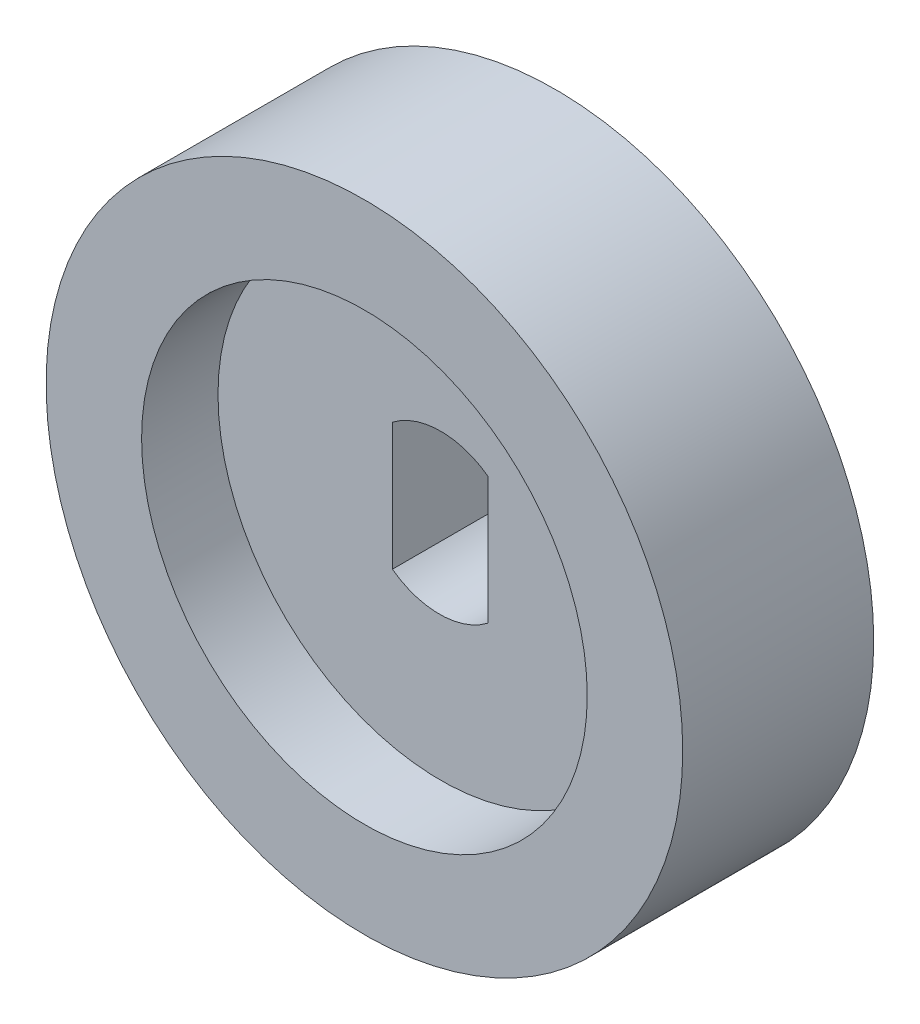
from build123d import *

# Parameters (mm, degrees)
SKETCH1_R           = 10
BOSS_EXTRUDE1_DEPTH = 3
SKETCH2_R           = 7
CUT_EXTRUDE1_DEPTH  = 2.4


with BuildPart() as part:
    # Sketch1 → Boss-Extrude1 (new, symmetric)
    with BuildSketch(Plane.XY):
        Circle(SKETCH1_R)
        with BuildLine():
            Line((-1.521572539, 1.983637318), (-1.521572539, -2.016362682))
            ThreePointArc((-1.521572539, -2.016362682), (-0.016245384, -2.500087973), (1.478251514, -1.983871914))
            Line((1.478251514, -1.983871914), (1.478251514, 2.016128086))
            ThreePointArc((1.478251514, 2.016128086), (-0.02707564, 2.499853378), (-1.521572539, 1.983637318))
        make_face(mode=Mode.SUBTRACT)
    extrude(amount=BOSS_EXTRUDE1_DEPTH, both=True)

    # Sketch2 → Cut-Extrude1 (cut)
    with BuildSketch(Plane.XY.offset(3)):
        Circle(SKETCH2_R)
    extrude(amount=-CUT_EXTRUDE1_DEPTH, mode=Mode.SUBTRACT)


solid = part.part
